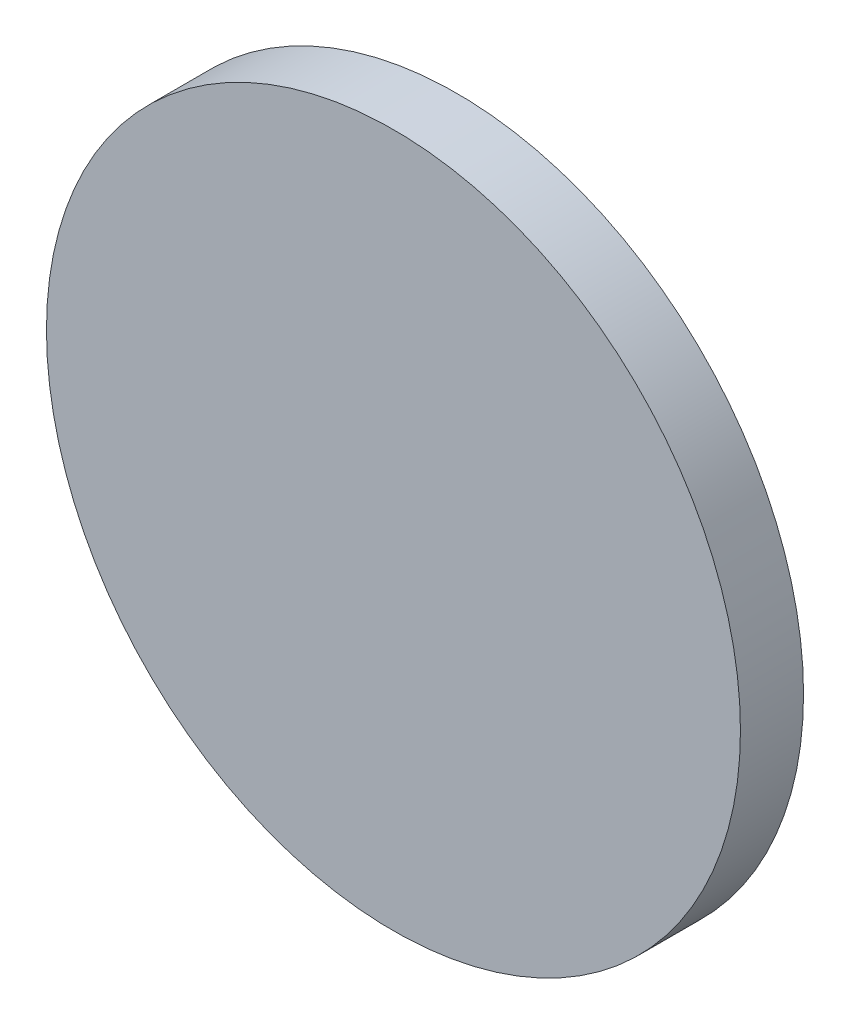
from build123d import *

# Parameters (mm, degrees)
CROQUIS1_R              = 11
SALIENTE_EXTRUIR1_DEPTH = 2


with BuildPart() as part:
    # Croquis1 → Saliente-Extruir1 (new body)
    with BuildSketch(Plane.XY):
        Circle(CROQUIS1_R)
    extrude(amount=SALIENTE_EXTRUIR1_DEPTH)


solid = part.part
